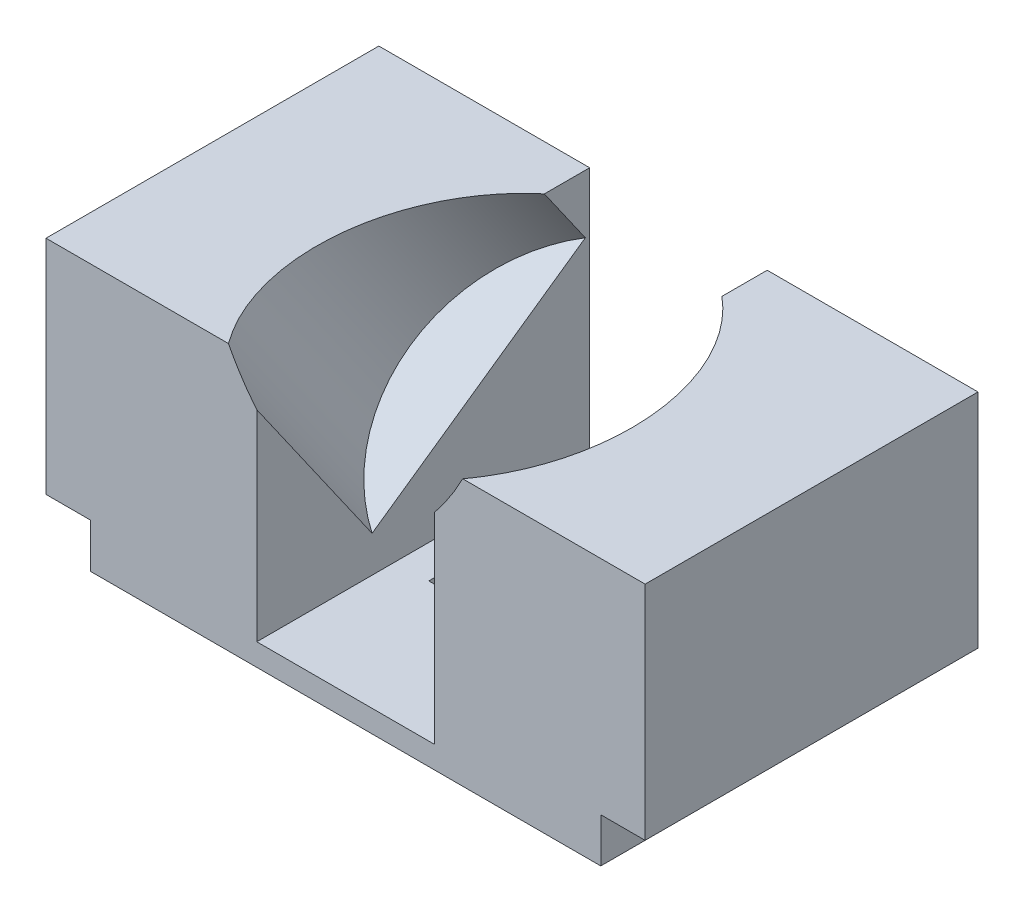
from build123d import *

# Parameters (mm, degrees)
SKETCH1_W               = 50.8
SKETCH1_H               = 30.48
BOSS_EXTRUDE1_DEPTH     = 34.29
SKETCH2_R               = 18.034
CUT_EXTRUDE1_DEPTH      = 46.312489448
SKETCH3_W               = 20.32
SKETCH3_H               = 27.94
CUT_EXTRUDE2_DEPTH      = 64.156169137
SKETCH4_W               = 12.7
SKETCH4_H               = 19.05
CUT_EXTRUDE3_DEPTH      = 46.312489448
SKETCH7_W               = 68.58
SKETCH7_H               = 12.7
CUT_EXTRUDE5_DEPTH      = 53.440389968
CUT_EXTRUDE6_DEPTH      = 46.312489448
CUT_EXTRUDE6_DEPTH_BACK = 46.312489448
SKETCH9_W               = 5.08
SKETCH9_H               = 5.08


with BuildPart() as part:
    # Sketch1 → Boss-Extrude1 (new, symmetric)
    with BuildSketch(Plane(origin=(0, 0, 0), x_dir=(0, 0, -1), z_dir=(1, 0, 0))):
        Rectangle(SKETCH1_W, SKETCH1_H)
    extrude(amount=BOSS_EXTRUDE1_DEPTH, both=True)

    # Sketch2 → Cut-Extrude1 (cut, through all)
    with BuildSketch(Plane(origin=(0, 0, 0), x_dir=(1, 0, 0), z_dir=(0, 0.819152044288991, 0.5735764363510473))):
        Circle(SKETCH2_R)
    extrude(amount=CUT_EXTRUDE1_DEPTH, mode=Mode.SUBTRACT)

    # Sketch3 → Cut-Extrude2 (cut, through all)
    with BuildSketch(Plane.XY.offset(25.4)):
        with Locations((0, 1.27)):
            Rectangle(SKETCH3_W, SKETCH3_H)
    extrude(amount=-CUT_EXTRUDE2_DEPTH, mode=Mode.SUBTRACT)

    # Sketch4 → Cut-Extrude3 (cut, through all)
    with BuildSketch(Plane(origin=(0, 0, 0), x_dir=(1, 0, 0), z_dir=(0, 1, 0))):
        Rectangle(SKETCH4_W, SKETCH4_H)
    extrude(amount=-CUT_EXTRUDE3_DEPTH, mode=Mode.SUBTRACT)

    # Sketch7 → Cut-Extrude5 (cut, through all)
    with BuildSketch(Plane(origin=(0, 15.24, 0), x_dir=(1, 0, 0), z_dir=(0, 1, 0))):
        with Locations((0, 19.05)):
            Rectangle(SKETCH7_W, SKETCH7_H)
    extrude(amount=-CUT_EXTRUDE5_DEPTH, mode=Mode.SUBTRACT)

    # Sketch9 → Cut-Extrude6 (cut, two sides: drawn at the far end of the back side and taken through both)
    with BuildSketch(Plane.XY.offset(-CUT_EXTRUDE6_DEPTH_BACK)):
        with Locations((-31.75, -12.7)):
            Rectangle(SKETCH9_W, SKETCH9_H)
        with Locations((31.75, -12.7)):
            Rectangle(SKETCH9_W, SKETCH9_H)
    extrude(amount=CUT_EXTRUDE6_DEPTH + CUT_EXTRUDE6_DEPTH_BACK, mode=Mode.SUBTRACT)


solid = part.part
